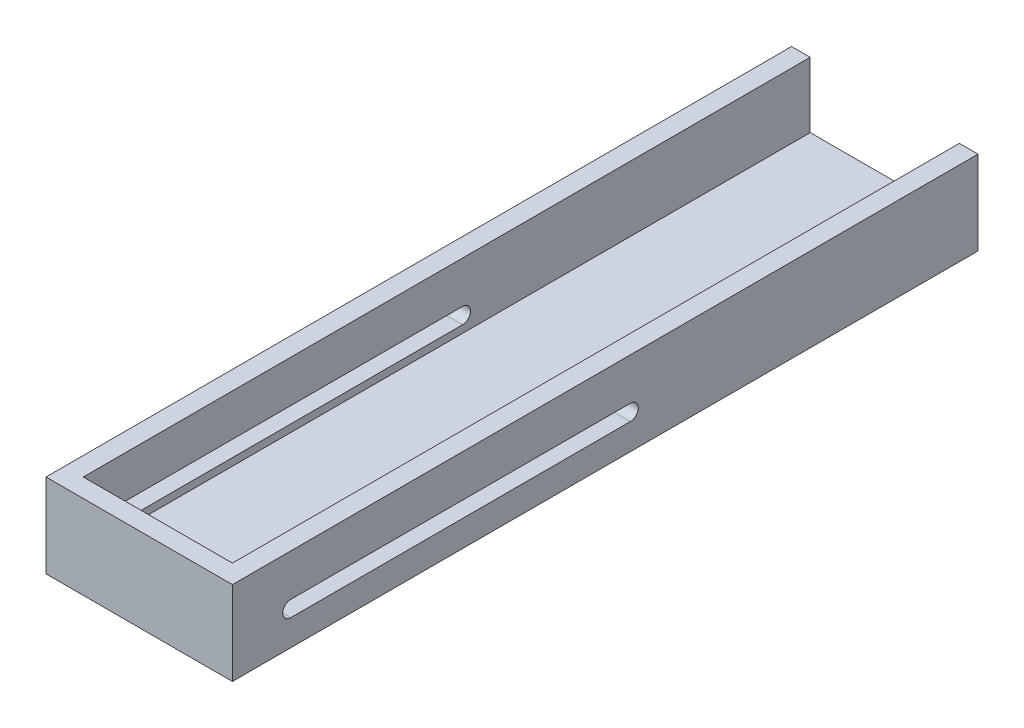
from build123d import *

# Parameters (mm, degrees)
SKETCH1_W           = 50
SKETCH1_H           = 200
BOSS_EXTRUDE1_DEPTH = 20
SKETCH2_W           = 40
SKETCH2_H           = 35
CUT_EXTRUDE1_DEPTH  = 190
SKETCH3_W           = 40
SKETCH3_H           = 17.5
CUT_EXTRUDE2_DEPTH  = 5
SKETCH4_W           = 50
SKETCH4_H           = 2.5
BOSS_EXTRUDE2_DEPTH = 200
CUT_EXTRUDE4_DEPTH  = 200
BOSS_EXTRUDE3_DEPTH = 50
SKETCH15_W          = 40
SKETCH15_H          = 4.25
CUT_EXTRUDE5_DEPTH  = 104
CUT_EXTRUDE6_DEPTH  = 104
BOSS_EXTRUDE4_DEPTH = 50
SKETCH19_W          = 40
SKETCH19_H          = 4.25
CUT_EXTRUDE7_DEPTH  = 50


with BuildPart() as part:
    # Sketch1 → Boss-Extrude1 (new body)
    with BuildSketch(Plane(origin=(0, 0, 0), x_dir=(1, 0, 0), z_dir=(0, 1, 0))):
        Rectangle(SKETCH1_W, SKETCH1_H)
    extrude(amount=BOSS_EXTRUDE1_DEPTH)

    # Sketch2 → Cut-Extrude1 (cut)
    with BuildSketch(Plane(origin=(0, 0, -100), x_dir=(-1, 0, 0), z_dir=(0, 0, -1))):
        with Locations((0, 20)):
            Rectangle(SKETCH2_W, SKETCH2_H)
    extrude(amount=-CUT_EXTRUDE1_DEPTH, mode=Mode.SUBTRACT)

    # Sketch3 → Cut-Extrude2 (cut)
    with BuildSketch(Plane(origin=(0, 0, 90), x_dir=(-1, 0, 0), z_dir=(0, 0, -1))):
        with Locations((0, 11.25)):
            Rectangle(SKETCH3_W, SKETCH3_H)
    extrude(amount=-CUT_EXTRUDE2_DEPTH, mode=Mode.SUBTRACT)

    # Sketch4 → Boss-Extrude2 (add)
    with BuildSketch(Plane(origin=(0, 0, -100), x_dir=(-1, 0, 0), z_dir=(0, 0, -1))):
        with Locations((0, -1.25)):
            Rectangle(SKETCH4_W, SKETCH4_H)
    extrude(amount=-BOSS_EXTRUDE2_DEPTH)

    # Sketch6 → Cut-Extrude4 (cut)
    with BuildSketch(Plane.ZY.offset(25)):
        with BuildLine():
            Line((90.75, 4.5), (-95.75, 4.5))
            ThreePointArc((-95.75, 4.5), (-97.875, 6.625), (-95.75, 8.75))
            Line((-95.75, 8.75), (90.75, 8.75))
            ThreePointArc((90.75, 8.75), (92.875, 6.625), (90.75, 4.5))
        make_face()
    extrude(amount=-CUT_EXTRUDE4_DEPTH, mode=Mode.SUBTRACT)

    # Sketch14 → Boss-Extrude3 (add)
    with BuildSketch(Plane.ZY.offset(25)):
        with BuildLine():
            Line((-0.375, 4.5), (-100, 4.5))
            Line((-100, 4.5), (-100, 8.75))
            Line((-100, 8.75), (-0.375, 8.75))
            ThreePointArc((-0.375, 8.75), (-2.5, 6.625), (-0.375, 4.5))
        make_face()
    extrude(amount=-BOSS_EXTRUDE3_DEPTH)

    # Sketch15 → Cut-Extrude5 (cut)
    with BuildSketch(Plane(origin=(0, 0, -100), x_dir=(-1, 0, 0), z_dir=(0, 0, -1))):
        with Locations((0, 6.625)):
            Rectangle(SKETCH15_W, SKETCH15_H)
    extrude(amount=-CUT_EXTRUDE5_DEPTH, mode=Mode.SUBTRACT)

    # Sketch17 → Cut-Extrude6 (cut)
    with BuildSketch(Plane.ZY.offset(25)):
        with BuildLine():
            Line((-0.375, 8.75), (-0.375, 4.5))
            Line((-0.375, 4.5), (-6.75, 4.5))
            ThreePointArc((-6.75, 4.5), (-8.875, 6.625), (-6.75, 8.75))
            Line((-6.75, 8.75), (-0.375, 8.75))
        make_face()
    extrude(amount=-CUT_EXTRUDE6_DEPTH, mode=Mode.SUBTRACT)

    # Sketch18 → Boss-Extrude4 (add)
    with BuildSketch(Plane.ZY.offset(25)):
        with BuildLine():
            Line((84.375, 4.5), (90.75, 4.5))
            ThreePointArc((90.75, 4.5), (92.875, 6.625), (90.75, 8.75))
            Line((90.75, 8.75), (84.375, 8.75))
            ThreePointArc((84.375, 8.75), (86.5, 6.625), (84.375, 4.5))
        make_face()
    extrude(amount=-BOSS_EXTRUDE4_DEPTH)

    # Sketch19 → Cut-Extrude7 (cut)
    with BuildSketch(Plane(origin=(0, 0, 95), x_dir=(-1, 0, 0), z_dir=(0, 0, -1))):
        with Locations((0, 6.625)):
            Rectangle(SKETCH19_W, SKETCH19_H)
    extrude(amount=CUT_EXTRUDE7_DEPTH, mode=Mode.SUBTRACT)


solid = part.part
